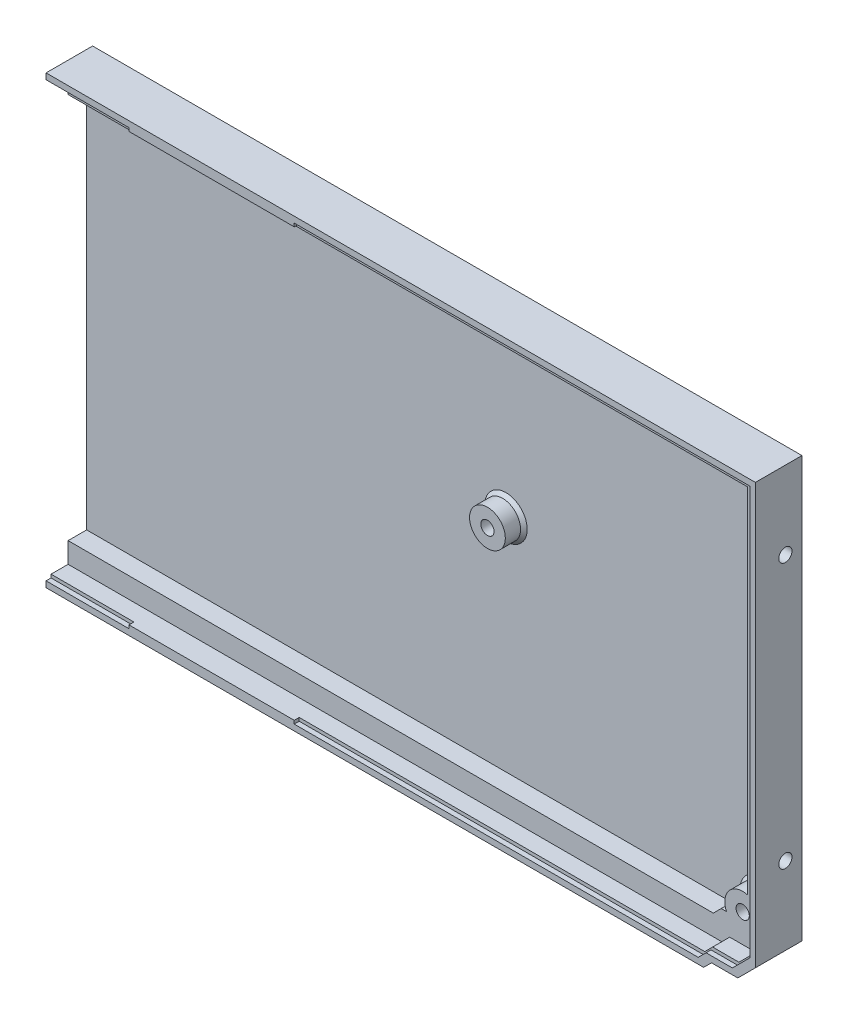
from build123d import *

# Parameters (mm, degrees)
P_IDAT_VYSUNUT_M1_DEPTH  = 5.6
SKO_EPINA1_T             = 1.8
P_IDAT_VYSUNUT_M3_DEPTH  = 5.15
P_IDAT_VYSUNUT_M4_DEPTH  = 7.4
P_IDAT_VYSUNUT_M5_DEPTH  = 1.5
SKICA14_W                = 49.9
SKICA14_H                = 0.995009232
P_IDAT_VYSUNUT_M6_DEPTH  = 1.5
SKICA15_R                = 5.4
SKICA15_W                = 3
SKICA15_H                = 9
P_IDAT_VYSUNUT_M7_DEPTH  = 5.6
SKICA16_R                = 2
ODEBRAT_VYSUNUT_M1_DEPTH = 5.75
ZKOSEN_1_SIZE            = 1
SKICA17_W                = 24
SKICA17_H                = 13.4
ODEBRAT_VYSUNUT_M2_DEPTH = 1.6
ODEBRAT_VYSUNUT_M3_REACH = 442.031
SKICA23_R                = 2
ODEBRAT_VYSUNUT_M4_DEPTH = 5.7
SKICA24_R                = 2
ODEBRAT_VYSUNUT_M5_DEPTH = 5.7
SKICA25_R                = 6.25
ODEBRAT_VYSUNUT_M6_DEPTH = 1.5
SKICA26_W                = 214.14008497
SKICA26_H                = 14.05
ODEBRAT_VYSUNUT_M7_DEPTH = 443.82576223


with BuildPart() as part:
    # Skica3 → Přidat vysunutím1 (new body)
    with BuildSketch(Plane.XY):
        Polygon((2.412545276, -4), (412.692715215, -4), (412.692715215, -118.191389918), (412.654731358, -118.229366948), (404.717731358, -118.229366948), (402.336688893, -120.609981536), (12.768122748, -120.609981536), (10.387229089, -118.22921813), (2.450229089, -118.22921813), (2.412545276, -118.191536378), align=None)
    extrude(amount=P_IDAT_VYSUNUT_M1_DEPTH)

    # Skořepina1
    sko_epina1_openings = [part.faces().sort_by_distance(p)[0] for p in [
        (207.552632266, -62.25279763, 5.6),
    ]]
    offset(amount=SKO_EPINA1_T, openings=sko_epina1_openings, kind=Kind.INTERSECTION)



with BuildPart() as body_2:
    # Skica7 → Přidat vysunutím3 (new body)
    with BuildSketch(Plane.XY.offset(5.6)):
        Polygon((-6.587454724, 5), (-6.587454724, -121.919602656), (-1.277548758, -127.22921813), (6.659451242, -127.22921813), (9.040344901, -129.609981536), (406.06413722, -129.609981536), (408.445179685, -127.229366948), (416.382179685, -127.229366948), (421.692715215, -121.919785731), (421.692715215, 5), align=None)
        Polygon((-3.787454724, 2.2), (-3.787454724, -120.759759814), (-0.11779565, -124.42921813), (7.81920435, -124.42921813), (10.200098009, -126.809981536), (404.904486629, -126.809981536), (407.285529094, -124.429366948), (415.222529094, -124.429366948), (418.892715215, -120.759840367), (418.892715215, 2.2), align=None, mode=Mode.SUBTRACT)
    extrude(amount=P_IDAT_VYSUNUT_M3_DEPTH)


with BuildPart() as part_1:
    add(part.part)

    add(body_2.part)  # Přidat vysunutím4 merges body 2
    # Skica8 → Přidat vysunutím4 (add)
    with BuildSketch(Plane(origin=(0, 0, 5.6), x_dir=(-1, 0, 0), z_dir=(0, 0, -1))):
        Polygon((-421.692715215, 5), (6.587454724, 5), (6.587454724, -121.919602656), (1.277548758, -127.22921813), (-6.659451242, -127.22921813), (-9.040344901, -129.609981536), (-406.06413722, -129.609981536), (-408.445179685, -127.229366948), (-416.382179685, -127.229366948), (-421.692715215, -121.919785731), align=None)
        Polygon((-0.612545276, -2.2), (-0.612545276, -118.937149634), (-1.70467352, -120.02921813), (-9.64167352, -120.02921813), (-12.022567179, -122.409981536), (-403.082178558, -122.409981536), (-405.463221024, -120.029366948), (-413.400221024, -120.029366948), (-414.492715215, -118.93706908), (-414.492715215, -2.2), align=None, mode=Mode.SUBTRACT)
    extrude(amount=P_IDAT_VYSUNUT_M4_DEPTH)

    # Skica11 → Přidat vysunutím5 (add)
    with BuildSketch(Plane.XY.offset(10.75)):
        Polygon((421.692715215, 5), (-6.587454724, 5), (-6.587454724, -121.919602656), (-1.277548758, -127.22921813), (6.659451242, -127.22921813), (9.040344901, -129.609981536), (406.06413722, -129.609981536), (408.445179685, -127.229366948), (416.382179685, -127.229366948), (421.692715215, -121.919785731), align=None)
        Polygon((420.052630246, 3.195009232), (-4.947369754, 3.195009232), (-4.947369754, -120.114611888), (-0.239981646, -124.821742467), (7.697018354, -124.821742467), (10.68042987, -127.804990768), (404.42405225, -127.804990768), (406.805094715, -125.424376181), (414.742094715, -125.424376181), (420.052630246, -120.114794964), align=None, mode=Mode.SUBTRACT)
    extrude(amount=P_IDAT_VYSUNUT_M5_DEPTH)

    # Skica14 → Přidat vysunutím6 (add)
    with BuildSketch(Plane.XY.offset(10.75)):
        with Locations((157.582630246, 2.697504616)):
            Rectangle(SKICA14_W, SKICA14_H)
        with Locations((257.522630246, 2.697504616)):
            Rectangle(SKICA14_W, SKICA14_H)
        with Locations((257.52224106, -127.307486152)):
            Rectangle(SKICA14_W, SKICA14_H)
        with Locations((157.58224106, -127.307486152)):
            Rectangle(SKICA14_W, SKICA14_H)
    extrude(amount=P_IDAT_VYSUNUT_M6_DEPTH)

    # Skica15 → Přidat vysunutím7 (add)
    with BuildSketch(Plane.XY):
        with Locations((3.968545276, -115.95421813)):
            Circle(SKICA15_R)
        with Locations((33.491545276, -69.050981536)):
            Circle(SKICA15_R)
        with Locations((411.197715215, -115.879366948)):
            Circle(SKICA15_R)
        with Locations((334.147715215, -53.972)):
            Circle(SKICA15_R)
        with Locations((36.401545276, 0)):
            Rectangle(SKICA15_W, SKICA15_H)
    extrude(amount=P_IDAT_VYSUNUT_M7_DEPTH)

    # Skica16 → Odebrat vysunutím1 (cut)
    with BuildSketch(Plane.XY.offset(5.6)):
        with Locations((3.968545276, -115.95421813)):
            Circle(SKICA16_R)
        with Locations((33.491545276, -69.050981536)):
            Circle(SKICA16_R)
        with Locations((334.147715215, -53.972)):
            Circle(SKICA16_R)
        with Locations((411.197715215, -115.879366948)):
            Circle(SKICA16_R)
    extrude(amount=-ODEBRAT_VYSUNUT_M1_DEPTH, mode=Mode.SUBTRACT)

    # Zkosení1
    zkosen_1_edges = [part_1.edges().sort_by_distance(p)[0] for p in [
        (8.049207709, -112.417525591, 0),
        (28.091545276, -69.050981536, 0),
        (407.069426922, -112.398384936, 0),
        (328.747715215, -53.972, 0),
    ]]
    chamfer(zkosen_1_edges, length=ZKOSEN_1_SIZE)

    # Skica17 → Odebrat vysunutím2 (cut)
    with BuildSketch(Plane.XY.offset(5.6)):
        with Locations((36.401545276, -4.5)):
            Rectangle(SKICA17_W, SKICA17_H)
    extrude(amount=-ODEBRAT_VYSUNUT_M2_DEPTH, mode=Mode.SUBTRACT)

    # Odebrat vysunutím3: up to this face of the body (flat: up to its plane)
    odebrat_vysunut_m3_end = Plane(part_1.part.faces().sort_by_distance((207.552630246, 5, 5.225))[0])
    # Skica18 → Odebrat vysunutím3 (cut, up to the picked face)
    with BuildSketch(Plane.XZ.offset(4.5), mode=Mode.PRIVATE) as odebrat_vysunut_m3_sk1:
        with BuildLine():
            Line((33.651545276, 7.5), (39.151545276, 7.5))
            ThreePointArc((39.151545276, 7.5), (42.651545276, 4), (39.151545276, 0.5))
            Line((39.151545276, 0.5), (33.651545276, 0.5))
            ThreePointArc((33.651545276, 0.5), (30.151545276, 4), (33.651545276, 7.5))
        make_face()
    odebrat_vysunut_m3_tool1 = split(extrude(odebrat_vysunut_m3_sk1.sketch, amount=-ODEBRAT_VYSUNUT_M3_REACH, mode=Mode.PRIVATE), bisect_by=odebrat_vysunut_m3_end, keep=Keep.BOTH, mode=Mode.PRIVATE)
    add(odebrat_vysunut_m3_tool1.solids().sort_by(Axis((36.401545, -4.5, 4), (0, 1, 0)))[0], mode=Mode.SUBTRACT)

    # Skica23 → Odebrat vysunutím4 (cut)
    with BuildSketch(Plane.ZY.offset(6.587454724)):
        with Locations((3.2, -18.459801328)):
            Circle(SKICA23_R)
        with Locations((3.2, -98.459801328)):
            Circle(SKICA23_R)
    extrude(amount=-ODEBRAT_VYSUNUT_M4_DEPTH, mode=Mode.SUBTRACT)

    # Skica24 → Odebrat vysunutím5 (cut)
    with BuildSketch(Plane(origin=(421.692715215, 0, 0), x_dir=(0, 0, -1), z_dir=(1, 0, 0))):
        with Locations((-3.2, -18.459892866)):
            Circle(SKICA24_R)
        with Locations((-3.2, -98.459892866)):
            Circle(SKICA24_R)
    extrude(amount=-ODEBRAT_VYSUNUT_M5_DEPTH, mode=Mode.SUBTRACT)

    # Skica25 → Odebrat vysunutím6 (cut)
    with BuildSketch(Plane(origin=(0, 0, -1.8), x_dir=(-1, 0, 0), z_dir=(0, 0, -1))):
        with Locations((-401.692715215, -15)):
            Circle(SKICA25_R)
        with Locations((-13.412545276, -15)):
            Circle(SKICA25_R)
        with Locations((-388.445179685, -109.609981536)):
            Circle(SKICA25_R)
        with Locations((-26.659451242, -109.609981536)):
            Circle(SKICA25_R)
    extrude(amount=-ODEBRAT_VYSUNUT_M6_DEPTH, mode=Mode.SUBTRACT)

    # Skica26 → Odebrat vysunutím7 (cut, through all)
    with BuildSketch(Plane(origin=(0, 5, 0), x_dir=(1, 0, 0), z_dir=(0, 1, 0))):
        with Locations((100.482587761, -5.225)):
            Rectangle(SKICA26_W, SKICA26_H)
    extrude(amount=-ODEBRAT_VYSUNUT_M7_DEPTH, mode=Mode.SUBTRACT)


solid = part_1.part
